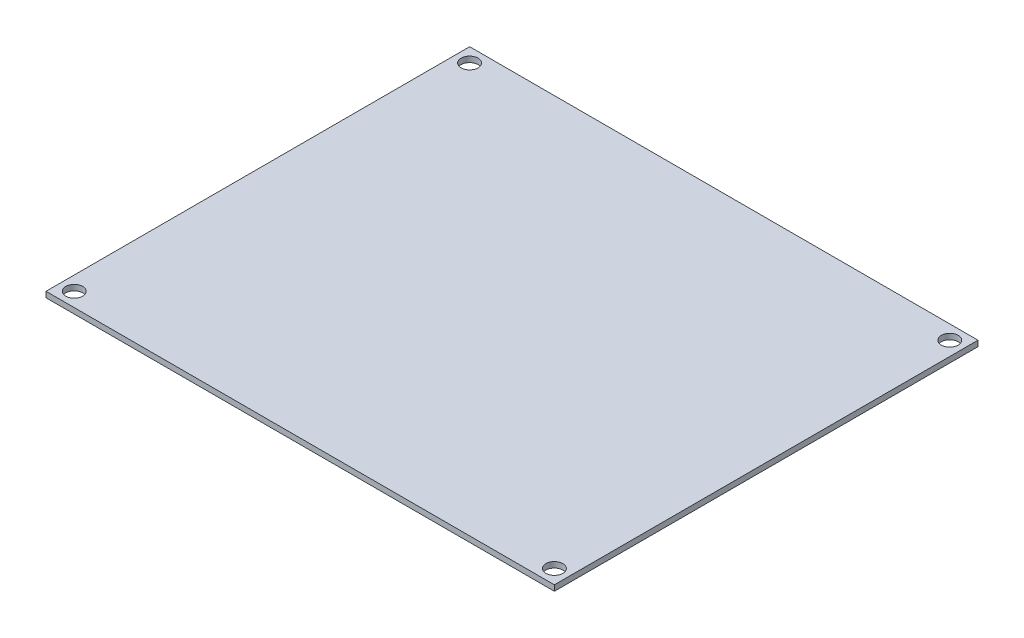
from build123d import *

# Parameters (mm, degrees)
SKETCH1_W           = 180
SKETCH1_H           = 150
SKETCH1_R           = 3
BOSS_EXTRUDE1_DEPTH = 2


with BuildPart() as part:
    # Sketch1 → Boss-Extrude1 (new body)
    with BuildSketch(Plane(origin=(0, 0, 0), x_dir=(1, 0, 0), z_dir=(0, 1, 0))):
        with Locations((0, -10)):
            Rectangle(SKETCH1_W, SKETCH1_H)
        with Locations(Location((-85, -80, 0), (0, 0, 270))):
            Circle(SKETCH1_R, mode=Mode.SUBTRACT)
        with Locations(Location((85, -80, 0), (0, 0, 90))):
            Circle(SKETCH1_R, mode=Mode.SUBTRACT)
        with Locations(Location((-85, 60, 0), (0, 0, 270))):
            Circle(SKETCH1_R, mode=Mode.SUBTRACT)
        with Locations(Location((85, 60, 0), (0, 0, 90))):
            Circle(SKETCH1_R, mode=Mode.SUBTRACT)
    extrude(amount=BOSS_EXTRUDE1_DEPTH)


solid = part.part
